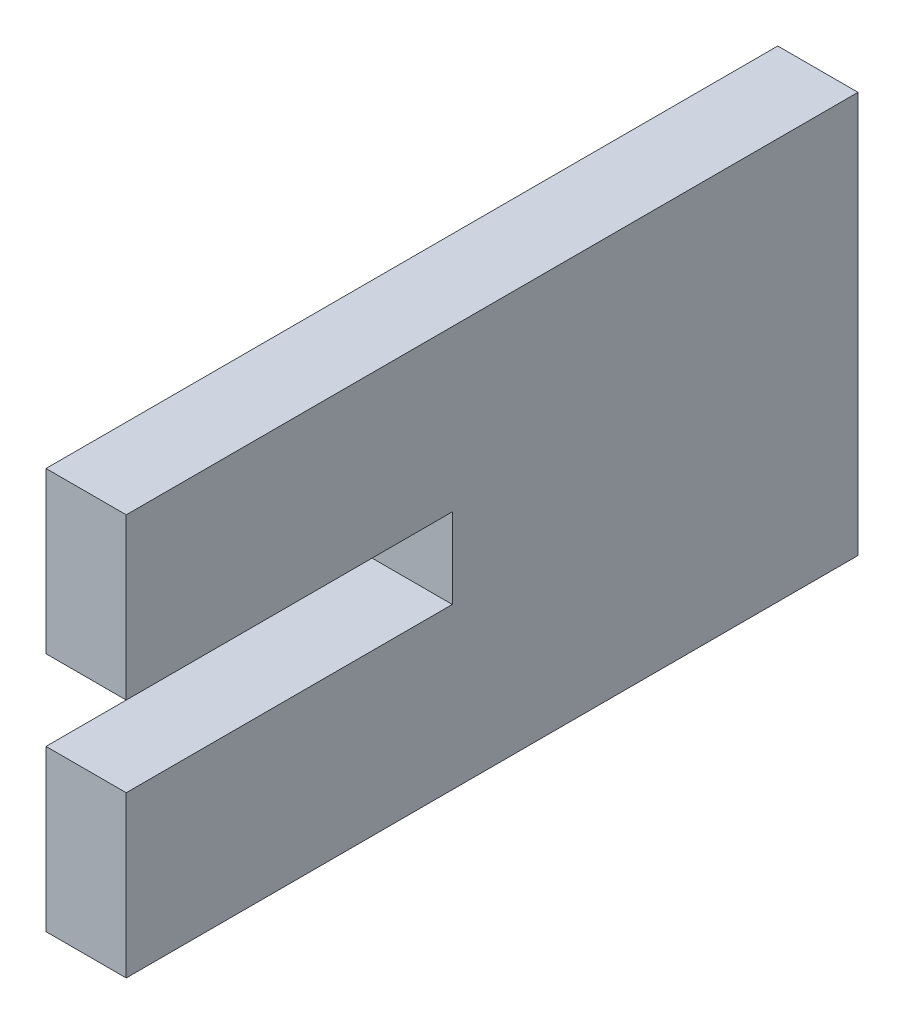
from build123d import *

# Parameters (mm, degrees)
BOSS_EXTRUDE1_DEPTH = 4


with BuildPart() as part:
    # Sketch1 → Boss-Extrude1 (new, symmetric)
    with BuildSketch(Plane(origin=(0, 0, 0), x_dir=(0, 0, -1), z_dir=(1, 0, 0))):
        Polygon((59.162013671, 20), (59.162013671, -20), (-13.806451613, -20), (-13.806451613, -4), (18.709677419, -4), (18.709677419, 4), (-13.806451613, 4), (-13.806451613, 20), align=None)
    extrude(amount=BOSS_EXTRUDE1_DEPTH, both=True)


solid = part.part
